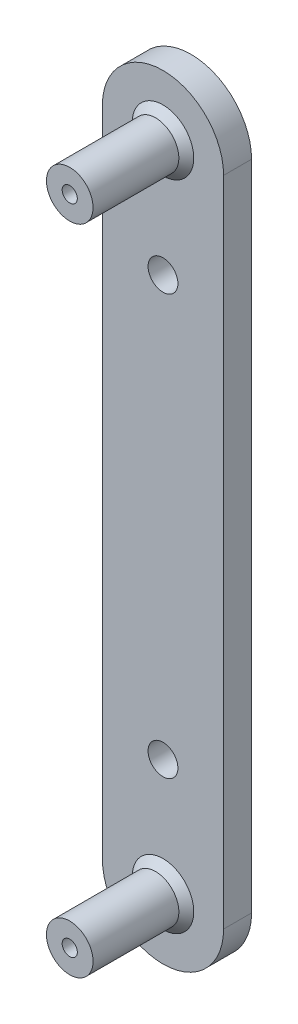
from build123d import *

# Parameters (mm, degrees)
SKETCH1_R             = 2.5
BOSS_EXTRUDE1_DEPTH   = 10
BOSS_EXTRUDE1_2_DEPTH = 10
BOSS_EXTRUDE2_DEPTH   = 3
SKETCH3_R             = 0.8125
CUT_EXTRUDE1_DEPTH    = 18
CHAMFER1_SIZE         = 0.8
SKETCH4_R             = 1.6
CUT_EXTRUDE2_DEPTH    = 10


with BuildPart() as part:
    # Sketch1 → Boss-Extrude1 (new body)
    with BuildSketch(Plane(origin=(0, 0, 0), x_dir=(0, 1, 0), z_dir=(0, 0, 1))):
        with Locations((-35, 0)):
            Circle(SKETCH1_R)
    extrude(amount=BOSS_EXTRUDE1_DEPTH)



with BuildPart() as body_2:
    # Sketch1 → Boss-Extrude1 2 (new body)
    with BuildSketch(Plane(origin=(0, 0, 0), x_dir=(0, 1, 0), z_dir=(0, 0, 1))):
        with Locations((35, 0)):
            Circle(SKETCH1_R)
    extrude(amount=BOSS_EXTRUDE1_2_DEPTH)


with BuildPart() as part_1:
    add(part.part)

    add(body_2.part)  # Boss-Extrude2 merges body 2
    # Sketch2 → Boss-Extrude2 (add)
    with BuildSketch(Plane(origin=(0, 0, 0), x_dir=(1, 0, 0), z_dir=(0, 0, -1))):
        with BuildLine():
            Line((6.5, 35), (6.5, -35))
            ThreePointArc((6.5, -35), (0, -41.5), (-6.5, -35))
            Line((-6.5, -35), (-6.5, 35))
            ThreePointArc((-6.5, 35), (0, 41.5), (6.5, 35))
        make_face()
    extrude(amount=BOSS_EXTRUDE2_DEPTH)

    # Sketch3 → Cut-Extrude1 (cut)
    with BuildSketch(Plane.XY.offset(10)):
        with Locations((0, -35)):
            Circle(SKETCH3_R)
        with Locations((0, 35)):
            Circle(SKETCH3_R)
    extrude(amount=-CUT_EXTRUDE1_DEPTH, mode=Mode.SUBTRACT)

    # Chamfer1
    chamfer1_edges = [part_1.edges().sort_by_distance(p)[0] for p in [
        (0, 32.5, 0),
        (0, -37.5, 0),
    ]]
    chamfer(chamfer1_edges, length=CHAMFER1_SIZE)

    # Sketch4 → Cut-Extrude2 (cut)
    with BuildSketch(Plane.XY):
        with Locations((0, 22.5)):
            Circle(SKETCH4_R)
        with Locations(Location((0, -22.5, 0), (0, 0, 180))):
            Circle(SKETCH4_R)
    extrude(amount=-CUT_EXTRUDE2_DEPTH, mode=Mode.SUBTRACT)


solid = part_1.part
